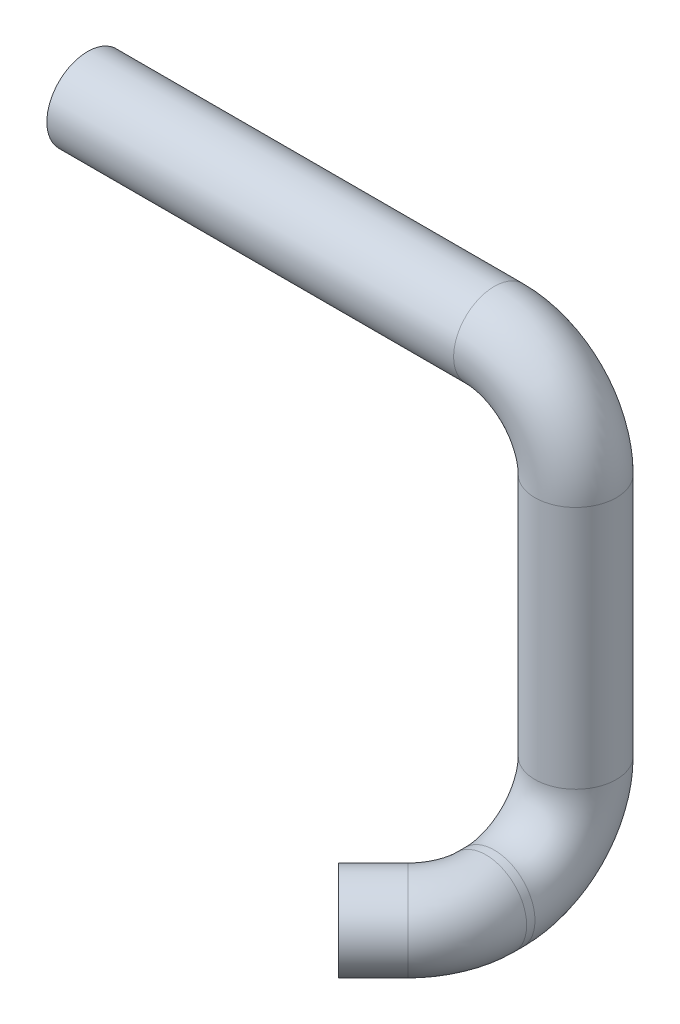
from build123d import *

# Parameters (mm, degrees)
SKETCH2_R   = 3.175
SKETCH2_R_2 = 2.286


with BuildPart() as part:
    # Sweep1: sweep along a curve in space
    with BuildLine() as sweep1_path:
        Line((0, 0, 0), (31.75, 0, 0))
        ThreePointArc((31.75, 0, 0), (36.240128061, -1.859871939, 0), (38.1, -6.35, 0))
        Line((38.1, -6.35, 0), (38.1, -25.4, 0))
        ThreePointArc((38.1, -25.4, 0), (38.1, -29.890128061, 1.859871939), (38.1, -31.75, 6.35))
        Line((38.1, -31.75, 6.35), (38.1, -31.75, 6.999954124))
        ThreePointArc((38.1, -31.75, 6.999954124), (37.63596963, -31.75, 9.332792327), (36.314522938, -31.75, 11.310477062))
        Line((36.314522938, -31.75, 11.310477062), (33.609871939, -31.75, 14.015128061))
    # Sketch2 → Sweep1 (sweep)
    with BuildSketch(Plane(origin=(0, 0, 0), x_dir=(0, 0, -1), z_dir=(1, 0, 0))):
        Circle(SKETCH2_R)
        Circle(SKETCH2_R_2, mode=Mode.SUBTRACT)
    sweep(path=sweep1_path.line)


solid = part.part
